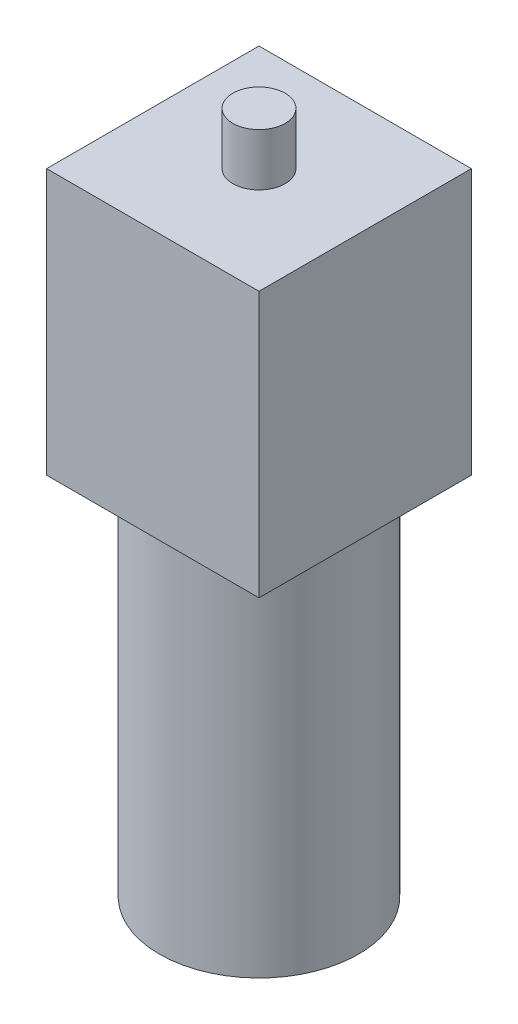
from build123d import *

# Parameters (mm, degrees)
SKETCH1_R           = 19.05
BOSS_EXTRUDE1_DEPTH = 69.85
SKETCH2_W           = 40.64
SKETCH2_H           = 40.64
BOSS_EXTRUDE2_DEPTH = 50.8
SKETCH3_R           = 5
BOSS_EXTRUDE3_DEPTH = 10


with BuildPart() as part:
    # Sketch1 → Boss-Extrude1 (new body)
    with BuildSketch(Plane(origin=(0, 0, 0), x_dir=(1, 0, 0), z_dir=(0, 1, 0))):
        with Locations(Location((0, 0, 0), (0, 0, 270))):
            Circle(SKETCH1_R)
    extrude(amount=BOSS_EXTRUDE1_DEPTH)

    # Sketch2 → Boss-Extrude2 (add)
    with BuildSketch(Plane(origin=(0, 69.85, 0), x_dir=(1, 0, 0), z_dir=(0, 1, 0))):
        Rectangle(SKETCH2_W, SKETCH2_H)
    extrude(amount=BOSS_EXTRUDE2_DEPTH)

    # Sketch3 → Boss-Extrude3 (add)
    with BuildSketch(Plane(origin=(0, 120.65, 0), x_dir=(1, 0, 0), z_dir=(0, 1, 0))):
        with Locations(Location((0, 0, 0), (0, 0, 270))):
            Circle(SKETCH3_R)
    extrude(amount=BOSS_EXTRUDE3_DEPTH)


solid = part.part
